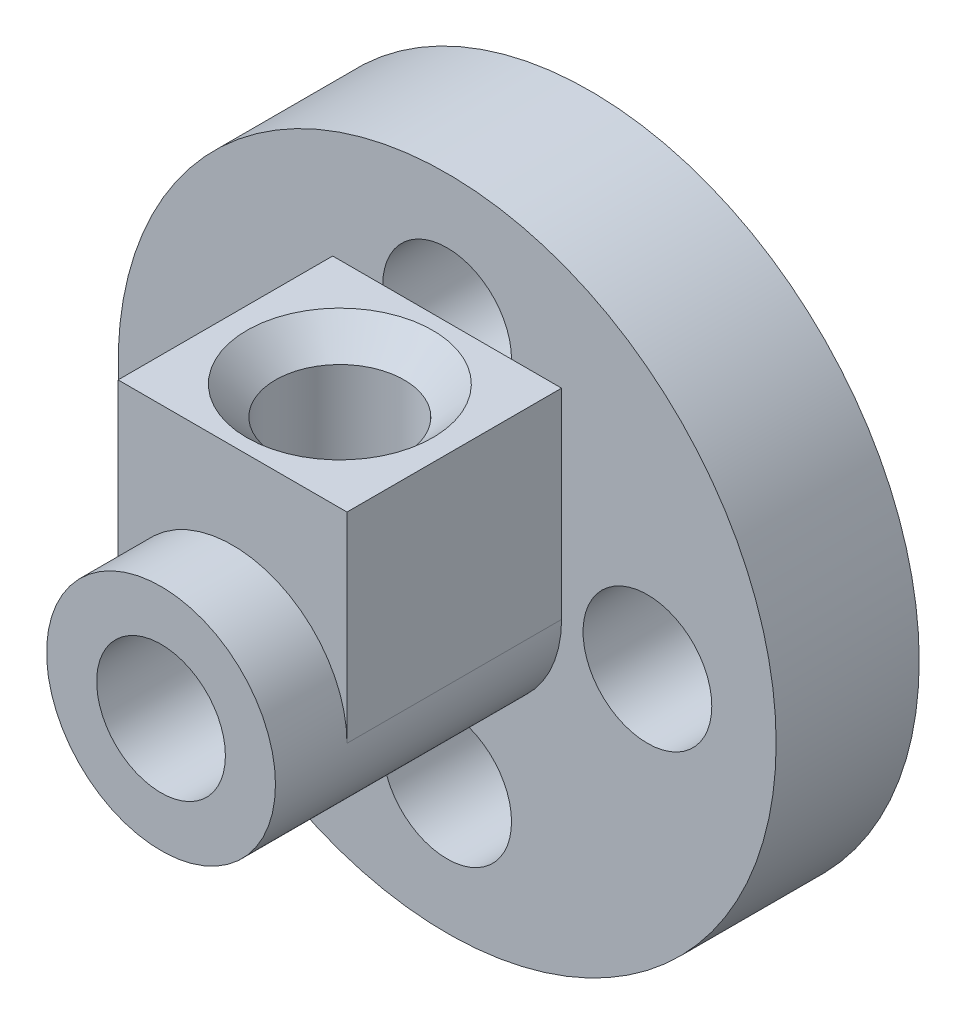
from build123d import *

# Parameters (mm, degrees)
SKETCH1_R                = 11.5
BOSS_EXTRUDE1_DEPTH      = 5
SKETCH2_R                = 2.25
CUT_EXTRUDE1_DEPTH       = 18.014699527
CIRPATTERN1_COUNT        = 4
SKETCH3_R                = 4
BOSS_EXTRUDE2_DEPTH      = 10
SKETCH4_R                = 2.25
CUT_EXTRUDE2_DEPTH       = 23.12464689
BOSS_EXTRUDE3_REACH      = 28.448
BOSS_EXTRUDE3_END_RADIUS = 4
SKETCH5_W                = 8
SKETCH5_H                = 7.5
SKETCH6_R                = 2.25
CUT_EXTRUDE3_DEPTH       = 7
CHAMFER1_SIZE            = 1
CHAMFER2_SIZE            = 1


with BuildPart() as part:
    # Sketch1 → Boss-Extrude1 (new body)
    with BuildSketch(Plane.XY):
        Circle(SKETCH1_R)
    extrude(amount=BOSS_EXTRUDE1_DEPTH)

    # Sketch2 → Cut-Extrude1 (cut, through all)
    with BuildSketch(Plane.XY.offset(5)):
        with Locations((0, 7)):
            Circle(SKETCH2_R)
    cut_extrude1 = extrude(amount=-CUT_EXTRUDE1_DEPTH, mode=Mode.SUBTRACT)

    # CirPattern1: Cut-Extrude1 ×4 about axis
    cirpattern1_axis = Axis((0, 0, 0), (0, 0, 1))
    for i in range(1, CIRPATTERN1_COUNT):
        add(cut_extrude1.rotate(cirpattern1_axis, i * 360 / CIRPATTERN1_COUNT), mode=Mode.SUBTRACT)

    # Sketch3 → Boss-Extrude2 (add)
    with BuildSketch(Plane.XY.offset(5)):
        Circle(SKETCH3_R)
    extrude(amount=BOSS_EXTRUDE2_DEPTH)

    # Sketch4 → Cut-Extrude2 (cut, through all)
    with BuildSketch(Plane.XY.offset(15)):
        Circle(SKETCH4_R)
    extrude(amount=-CUT_EXTRUDE2_DEPTH, mode=Mode.SUBTRACT)

    # Boss-Extrude3: up to this cylinder (the profile starts outside it)
    boss_extrude3_end = Plane(origin=(0, 0, 8.75), z_dir=(0, 0, -1)) * Cylinder(BOSS_EXTRUDE3_END_RADIUS, 65.896, mode=Mode.PRIVATE)
    # Sketch5 → Boss-Extrude3 (add, up to the surface)
    with BuildSketch(Plane(origin=(0, 7, 0), x_dir=(1, 0, 0), z_dir=(0, 1, 0)), mode=Mode.PRIVATE) as boss_extrude3_sk1:
        with Locations((0, -8.75)):
            Rectangle(SKETCH5_W, SKETCH5_H)
    boss_extrude3_tool1 = extrude(boss_extrude3_sk1.sketch, amount=-BOSS_EXTRUDE3_REACH, mode=Mode.PRIVATE) - boss_extrude3_end
    add(boss_extrude3_tool1.solids().sort_by_distance((0, 7, 8.75))[0])

    # Sketch6 → Cut-Extrude3 (cut)
    with BuildSketch(Plane(origin=(0, 7, 0), x_dir=(1, 0, 0), z_dir=(0, 1, 0))):
        with Locations(Location((0, -8.75, 0), (0, 0, 270))):
            Circle(SKETCH6_R)
    extrude(amount=-CUT_EXTRUDE3_DEPTH, mode=Mode.SUBTRACT)

    # Chamfer1
    chamfer1_edges = [part.edges().sort_by_distance(p)[0] for p in [
        (0, 7, 6.5),
    ]]
    chamfer(chamfer1_edges, length=CHAMFER1_SIZE)

    # Chamfer2
    chamfer2_edges = [part.edges().sort_by_distance(p)[0] for p in [
        (-7, -2.25, 0),
        (2.25, -7, 0),
        (7, 2.25, 0),
        (-2.25, 7, 0),
    ]]
    chamfer(chamfer2_edges, length=CHAMFER2_SIZE)


solid = part.part
